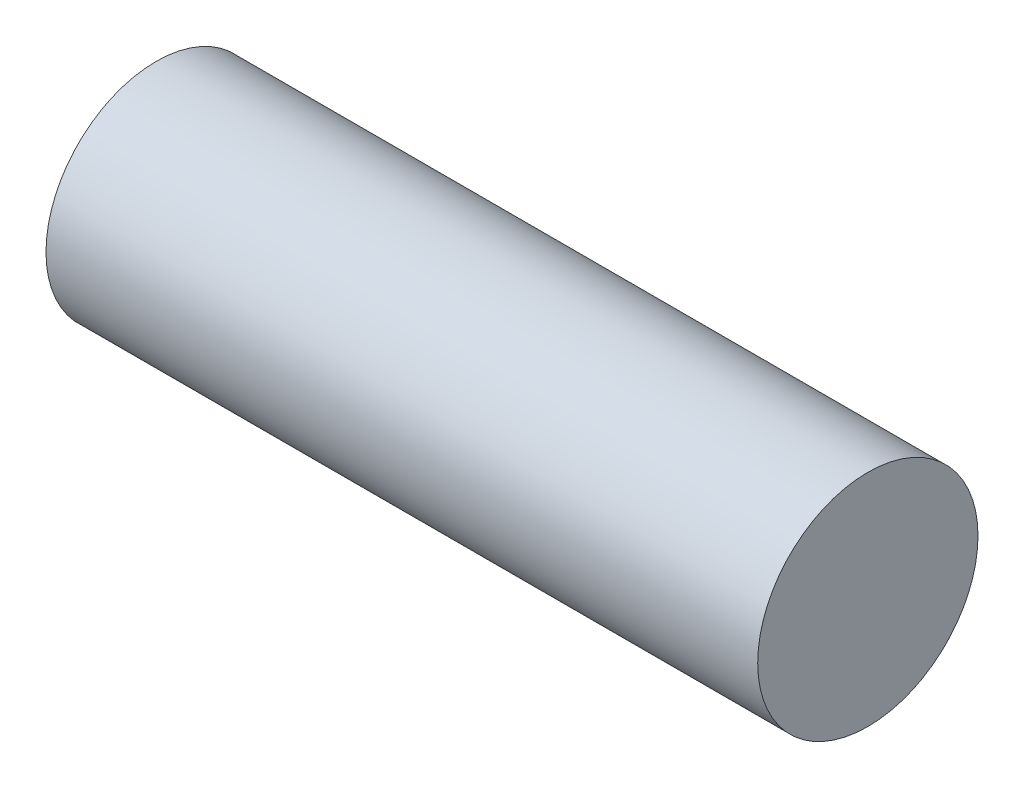
from build123d import *

# Parameters (mm, degrees)
SKETCH_1_R      = 6.5
EXTRUDE_1_DEPTH = 42


with BuildPart() as part:
    # 草图1 → 凸台-拉伸1 (new body)
    with BuildSketch(Plane(origin=(0, 0, 0), x_dir=(0, 0, -1), z_dir=(1, 0, 0))):
        Circle(SKETCH_1_R)
    extrude(amount=-EXTRUDE_1_DEPTH)


solid = part.part
